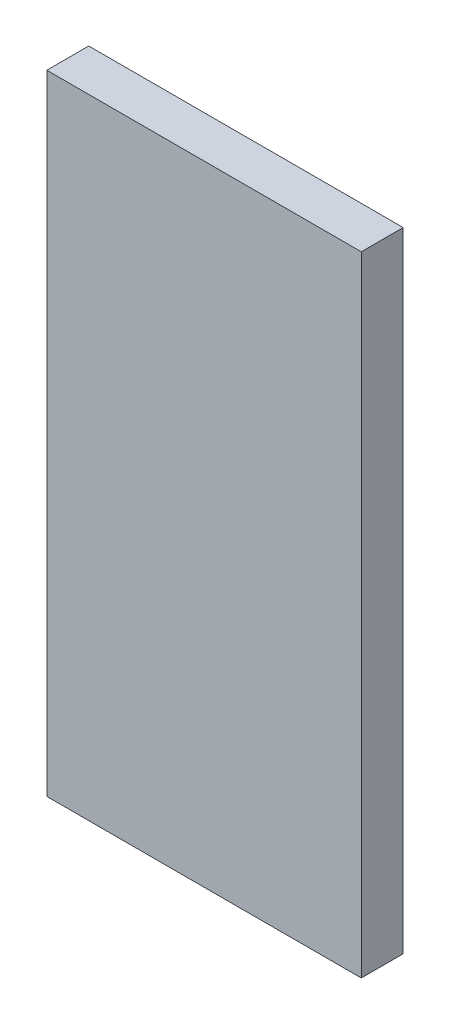
from build123d import *

# Parameters (mm, degrees)
SKETCH1_W           = 15
SKETCH1_H           = 30
BOSS_EXTRUDE1_DEPTH = 2


with BuildPart() as part:
    # Sketch1 → Boss-Extrude1 (new body)
    with BuildSketch(Plane.XY):
        Rectangle(SKETCH1_W, SKETCH1_H)
    extrude(amount=BOSS_EXTRUDE1_DEPTH)


solid = part.part
